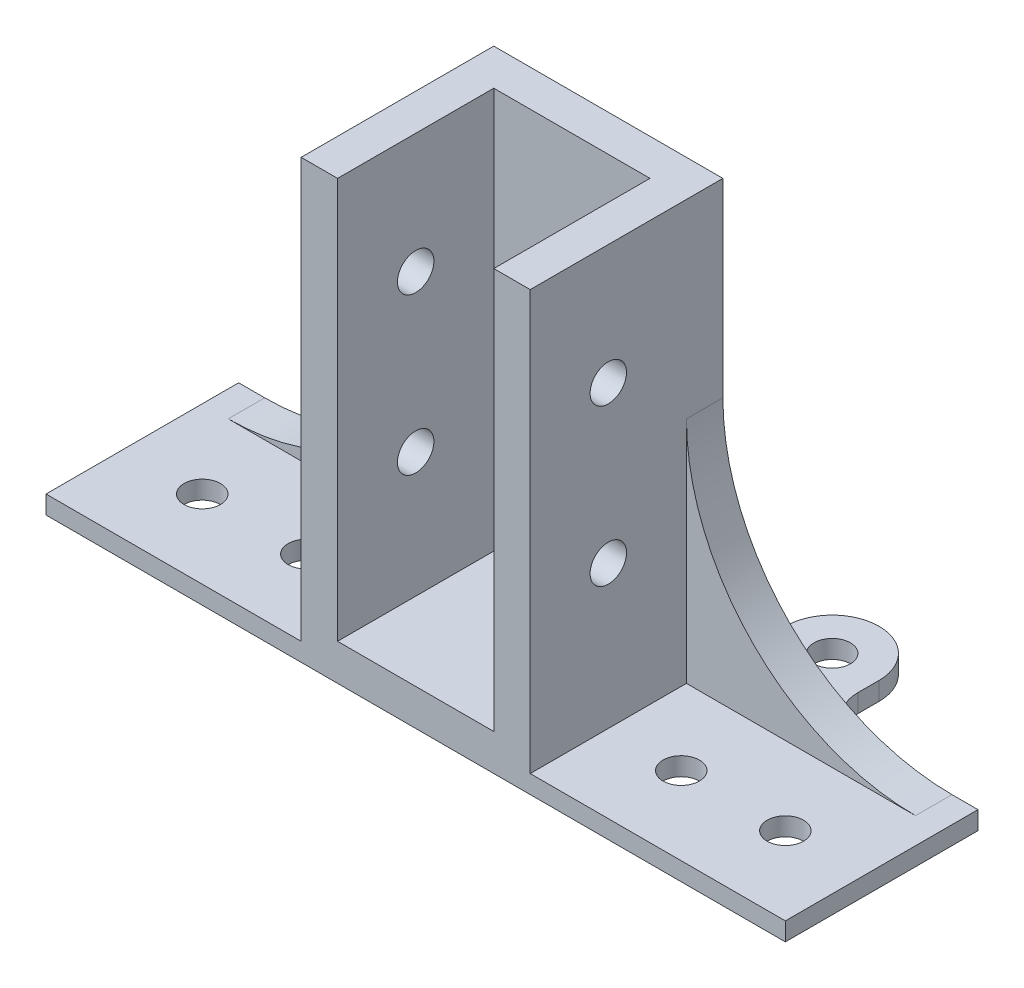
from build123d import *

# Parameters (mm, degrees)
SKETCH1_W           = 22
SKETCH1_H           = 42
BOSS_EXTRUDE1_DEPTH = 18.5
SKETCH2_W           = 15
SKETCH2_H           = 38.5
CUT_EXTRUDE1_DEPTH  = 15
SKETCH3_W           = 24.5
SKETCH3_H           = 1.75
BOSS_EXTRUDE2_DEPTH = 18.5
BOSS_EXTRUDE3_DEPTH = 3.5
SKETCH5_R           = 1.75
BOSS_EXTRUDE4_DEPTH = 1.75
SKETCH6_R           = 1.75
CUT_EXTRUDE2_DEPTH  = 10
FILLET1_R           = 4
SKETCH7_R           = 1.75
CUT_EXTRUDE3_DEPTH  = 28
SKETCH8_R           = 1.75
CUT_EXTRUDE4_DEPTH  = 28


with BuildPart() as part:
    # Sketch1 → Boss-Extrude1 (new body)
    with BuildSketch(Plane.XY):
        with Locations((-5.139289452, 23.868914656)):
            Rectangle(SKETCH1_W, SKETCH1_H)
    extrude(amount=BOSS_EXTRUDE1_DEPTH)

    # Sketch2 → Cut-Extrude1 (cut)
    with BuildSketch(Plane.XY.offset(18.5)):
        with Locations((-5.139289452, 25.618914656)):
            Rectangle(SKETCH2_W, SKETCH2_H)
    extrude(amount=-CUT_EXTRUDE1_DEPTH, mode=Mode.SUBTRACT)

    # Sketch3 → Boss-Extrude2 (add)
    with BuildSketch(Plane(origin=(0, 0, 0), x_dir=(-1, 0, 0), z_dir=(0, 0, -1))):
        with Locations((28.389289452, 3.743914656)):
            Rectangle(SKETCH3_W, SKETCH3_H)
        with Locations((-18.110710548, 3.743914656)):
            Rectangle(SKETCH3_W, SKETCH3_H)
    extrude(amount=-BOSS_EXTRUDE2_DEPTH)

    # Sketch4 → Boss-Extrude3 (add)
    with BuildSketch(Plane(origin=(0, 0, 0), x_dir=(-1, 0, 0), z_dir=(0, 0, -1))):
        with BuildLine():
            Line((38.139289452, 4.618914656), (16.139289452, 4.618914656))
            Line((16.139289452, 4.618914656), (16.139289452, 26.618914656))
            ThreePointArc((16.139289452, 26.618914656), (22.582940266, 11.06256547), (38.139289452, 4.618914656))
        make_face()
        with BuildLine():
            Line((-27.860710548, 4.618914656), (-5.860710548, 4.618914656))
            Line((-5.860710548, 4.618914656), (-5.860710548, 26.618914656))
            ThreePointArc((-5.860710548, 26.618914656), (-12.304361361, 11.06256547), (-27.860710548, 4.618914656))
        make_face()
    extrude(amount=-BOSS_EXTRUDE3_DEPTH)

    # Sketch5 → Boss-Extrude4 (add)
    # profile 1 of 2: a face of its own
    with BuildSketch(Plane.XZ.offset(-2.868914656)):
        with BuildLine():
            Line((14.860710548, -6), (14.860710548, 0))
            Line((14.860710548, 0), (5.860710548, 0))
            Line((5.860710548, 0), (5.860710548, -6))
            ThreePointArc((5.860710548, -6), (10.360710548, -10.5), (14.860710548, -6))
        make_face()
        with Locations(Location((10.360710548, -6, 0), (0, 0, 270))):
            Circle(SKETCH5_R, mode=Mode.SUBTRACT)
    # profile 2 of 2: a face of its own
    with BuildSketch(Plane.XZ.offset(-2.868914656)):
        with BuildLine():
            Line((-25.139289452, -6), (-25.139289452, 0))
            Line((-25.139289452, 0), (-16.139289452, 0))
            Line((-16.139289452, 0), (-16.139289452, -6))
            ThreePointArc((-16.139289452, -6), (-20.639289452, -10.5), (-25.139289452, -6))
        make_face()
        with Locations(Location((-20.639289452, -6, 0), (0, 0, 270))):
            Circle(SKETCH5_R, mode=Mode.SUBTRACT)
    extrude(amount=-BOSS_EXTRUDE4_DEPTH)

    # Sketch6 → Cut-Extrude2 (cut)
    with BuildSketch(Plane(origin=(0, 4.618914656, 0), x_dir=(1, 0, 0), z_dir=(0, 1, 0))):
        with Locations(Location((22.860710548, -11, 0), (0, 0, 270))):
            Circle(SKETCH6_R)
        with Locations(Location((-33.139289452, -11, 0), (0, 0, 270))):
            Circle(SKETCH6_R)
        with Locations(Location((12.860710548, -11, 0), (0, 0, 270))):
            Circle(SKETCH6_R)
        with Locations(Location((-23.139289452, -11, 0), (0, 0, 270))):
            Circle(SKETCH6_R)
    extrude(amount=-CUT_EXTRUDE2_DEPTH, mode=Mode.SUBTRACT)

    # Fillet1
    fillet1_edges = [part.edges().sort_by_distance(p)[0] for p in [
        (14.860710548, 3.743914656, 0),
        (5.860710548, 3.743914656, 0),
        (-25.139289452, 3.743914656, 0),
        (-16.139289452, 3.743914656, 0),
    ]]
    fillet(fillet1_edges, radius=FILLET1_R)

    # Sketch7 → Cut-Extrude3 (cut)
    with BuildSketch(Plane.ZY.offset(16.139289452)):
        with Locations(Location((11, 33.368914656, 0), (0, 0, 270))):
            Circle(SKETCH7_R)
        with Locations(Location((11, 18.368914656, 0), (0, 0, 270))):
            Circle(SKETCH7_R)
    extrude(amount=-CUT_EXTRUDE3_DEPTH, mode=Mode.SUBTRACT)

    # Sketch8 → Cut-Extrude4 (cut)
    with BuildSketch(Plane(origin=(0, 0, 0), x_dir=(-1, 0, 0), z_dir=(0, 0, -1))):
        with Locations((5.139289452, 33.368914656)):
            Circle(SKETCH8_R)
        with Locations((5.139289452, 18.368914656)):
            Circle(SKETCH8_R)
    extrude(amount=-CUT_EXTRUDE4_DEPTH, mode=Mode.SUBTRACT)


solid = part.part
